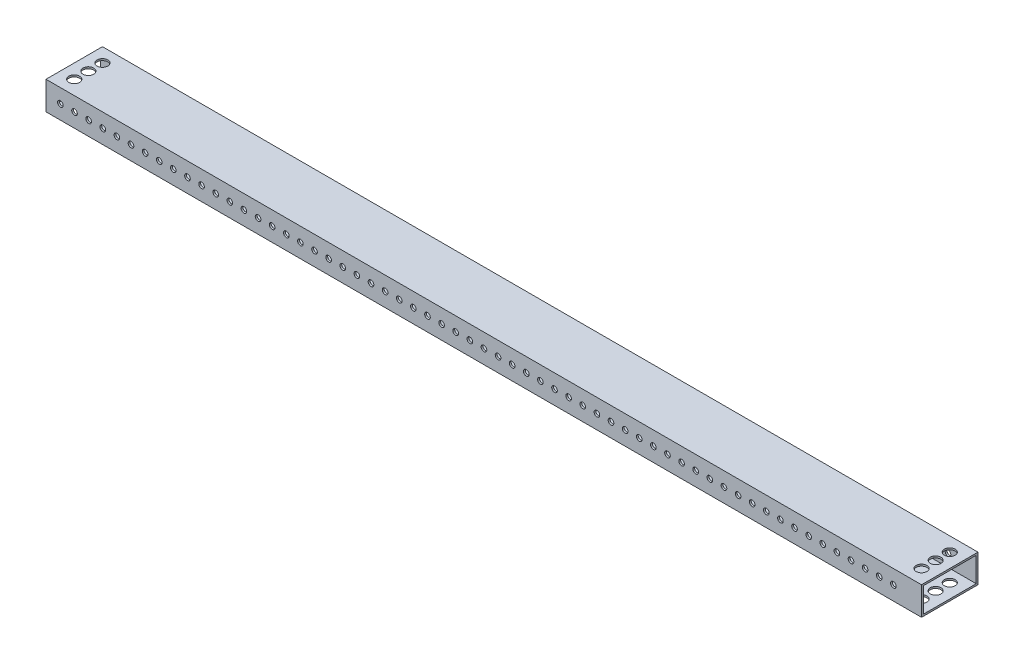
from build123d import *

# Parameters (mm, degrees)
SKETCH1_W           = 787.580141844
SKETCH1_H           = 50.8
BOSS_EXTRUDE1_DEPTH = 25.4
SKETCH2_W           = 47.577219443
SKETCH2_H           = 22.157059011
CUT_EXTRUDE1_DEPTH  = 789.398883705
SKETCH3_R           = 2.54
CUT_EXTRUDE2_DEPTH  = 398.864826237
SKETCH4_R           = 4.826
CUT_EXTRUDE3_DEPTH  = 396.4250118


with BuildPart() as part:
    # Sketch1 → Boss-Extrude1 (new body)
    with BuildSketch(Plane(origin=(0, 0, 0), x_dir=(1, 0, 0), z_dir=(0, 1, 0))):
        Rectangle(SKETCH1_W, SKETCH1_H)
    extrude(amount=BOSS_EXTRUDE1_DEPTH)

    # Sketch2 → Cut-Extrude1 (cut, through all)
    with BuildSketch(Plane.ZY.offset(393.790070922)):
        with Locations((0.005055824, 12.705024393)):
            Rectangle(SKETCH2_W, SKETCH2_H)
    extrude(amount=-CUT_EXTRUDE1_DEPTH, mode=Mode.SUBTRACT)

    # Sketch3 → Cut-Extrude2 (cut, through all)
    with BuildSketch(Plane.XY.offset(25.4)):
        with Locations((-380.836070922, 12.7)):
            Circle(SKETCH3_R)
        with Locations((-368.136070922, 12.7)):
            Circle(SKETCH3_R)
        with Locations((-355.436070922, 12.7)):
            Circle(SKETCH3_R)
        with Locations((-342.736070922, 12.7)):
            Circle(SKETCH3_R)
        with Locations((-330.036070922, 12.7)):
            Circle(SKETCH3_R)
        with Locations((-317.336070922, 12.7)):
            Circle(SKETCH3_R)
        with Locations((-304.636070922, 12.7)):
            Circle(SKETCH3_R)
        with Locations((-291.936070922, 12.7)):
            Circle(SKETCH3_R)
        with Locations((-279.236070922, 12.7)):
            Circle(SKETCH3_R)
        with Locations((-266.536070922, 12.7)):
            Circle(SKETCH3_R)
        with Locations((-253.836070922, 12.7)):
            Circle(SKETCH3_R)
        with Locations((-241.136070922, 12.7)):
            Circle(SKETCH3_R)
        with Locations((-228.436070922, 12.7)):
            Circle(SKETCH3_R)
        with Locations((-215.736070922, 12.7)):
            Circle(SKETCH3_R)
        with Locations((-203.036070922, 12.7)):
            Circle(SKETCH3_R)
        with Locations((-190.336070922, 12.7)):
            Circle(SKETCH3_R)
        with Locations((-177.636070922, 12.7)):
            Circle(SKETCH3_R)
        with Locations((-164.936070922, 12.7)):
            Circle(SKETCH3_R)
        with Locations((-152.236070922, 12.7)):
            Circle(SKETCH3_R)
        with Locations((-139.536070922, 12.7)):
            Circle(SKETCH3_R)
        with Locations((-126.836070922, 12.7)):
            Circle(SKETCH3_R)
        with Locations((-114.136070922, 12.7)):
            Circle(SKETCH3_R)
        with Locations((-101.436070922, 12.7)):
            Circle(SKETCH3_R)
        with Locations((-88.736070922, 12.7)):
            Circle(SKETCH3_R)
        with Locations((-76.036070922, 12.7)):
            Circle(SKETCH3_R)
        with Locations((-63.336070922, 12.7)):
            Circle(SKETCH3_R)
        with Locations((-50.636070922, 12.7)):
            Circle(SKETCH3_R)
        with Locations((-37.936070922, 12.7)):
            Circle(SKETCH3_R)
        with Locations((-25.236070922, 12.7)):
            Circle(SKETCH3_R)
        with Locations((-12.536070922, 12.7)):
            Circle(SKETCH3_R)
        with Locations((0.163929078, 12.7)):
            Circle(SKETCH3_R)
        with Locations((12.863929078, 12.7)):
            Circle(SKETCH3_R)
        with Locations((25.563929078, 12.7)):
            Circle(SKETCH3_R)
        with Locations((38.263929078, 12.7)):
            Circle(SKETCH3_R)
        with Locations((50.963929078, 12.7)):
            Circle(SKETCH3_R)
        with Locations((63.663929078, 12.7)):
            Circle(SKETCH3_R)
        with Locations((76.363929078, 12.7)):
            Circle(SKETCH3_R)
        with Locations((89.063929078, 12.7)):
            Circle(SKETCH3_R)
        with Locations((101.763929078, 12.7)):
            Circle(SKETCH3_R)
        with Locations((114.463929078, 12.7)):
            Circle(SKETCH3_R)
        with Locations((127.163929078, 12.7)):
            Circle(SKETCH3_R)
        with Locations((139.863929078, 12.7)):
            Circle(SKETCH3_R)
        with Locations((152.563929078, 12.7)):
            Circle(SKETCH3_R)
        with Locations((165.263929078, 12.7)):
            Circle(SKETCH3_R)
        with Locations((177.963929078, 12.7)):
            Circle(SKETCH3_R)
        with Locations((190.663929078, 12.7)):
            Circle(SKETCH3_R)
        with Locations((203.363929078, 12.7)):
            Circle(SKETCH3_R)
        with Locations((216.063929078, 12.7)):
            Circle(SKETCH3_R)
        with Locations((228.763929078, 12.7)):
            Circle(SKETCH3_R)
        with Locations((241.463929078, 12.7)):
            Circle(SKETCH3_R)
        with Locations((254.163929078, 12.7)):
            Circle(SKETCH3_R)
        with Locations((266.863929078, 12.7)):
            Circle(SKETCH3_R)
        with Locations((279.563929078, 12.7)):
            Circle(SKETCH3_R)
        with Locations((292.263929078, 12.7)):
            Circle(SKETCH3_R)
        with Locations((304.963929078, 12.7)):
            Circle(SKETCH3_R)
        with Locations((317.663929078, 12.7)):
            Circle(SKETCH3_R)
        with Locations((330.363929078, 12.7)):
            Circle(SKETCH3_R)
        with Locations((343.063929078, 12.7)):
            Circle(SKETCH3_R)
        with Locations((355.763929078, 12.7)):
            Circle(SKETCH3_R)
        with Locations((368.463929078, 12.7)):
            Circle(SKETCH3_R)
    extrude(amount=-CUT_EXTRUDE2_DEPTH, mode=Mode.SUBTRACT)

    # Sketch4 → Cut-Extrude3 (cut, through all)
    with BuildSketch(Plane(origin=(0, 25.4, 0), x_dir=(1, 0, 0), z_dir=(0, 1, 0))):
        with Locations(Location((-381.090070922, 12.7, 0), (0, 0, 270))):
            Circle(SKETCH4_R)
        with Locations(Location((-381.090070922, -12.7, 0), (0, 0, 270))):
            Circle(SKETCH4_R)
        with Locations(Location((-381.090070922, 0, 0), (0, 0, 270))):
            Circle(SKETCH4_R)
        with Locations(Location((381.090070922, 12.7, 0), (0, 0, 270))):
            Circle(SKETCH4_R)
        with Locations(Location((381.090070922, 0, 0), (0, 0, 270))):
            Circle(SKETCH4_R)
        with Locations(Location((381.090070922, -12.7, 0), (0, 0, 270))):
            Circle(SKETCH4_R)
    extrude(amount=-CUT_EXTRUDE3_DEPTH, mode=Mode.SUBTRACT)


solid = part.part
